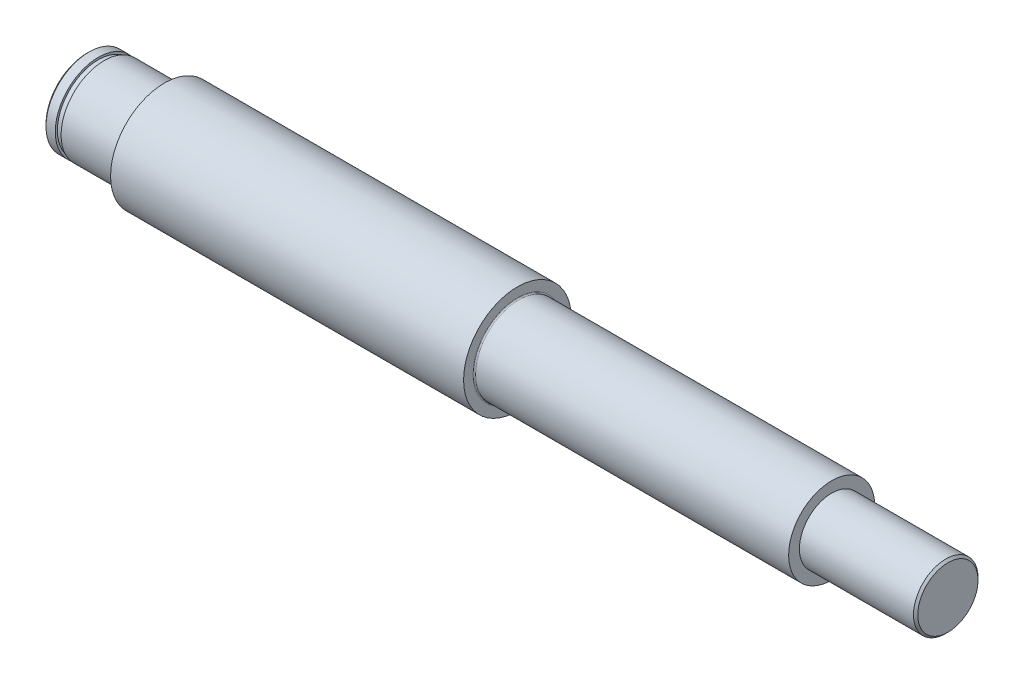
from build123d import *

# Parameters (mm, degrees)
FILLET1_R     = 0.3
CHAMFER1_SIZE = 0.5


with BuildPart() as part:
    # Sketch1 → Revolve1 (revolve)
    with BuildSketch(Plane.XY):
        Polygon((0, 0), (200, 0), (200, 7.5), (173, 7.5), (173, 10), (100, 10), (100, 12.5), (18, 12.5), (18, 10), (4, 10), (4, 9.5), (2.65, 9.5), (2.65, 10), (0, 10), align=None)
    revolve(axis=Axis((0, 0, 0), (1, 0, 0)))

    # Fillet1
    fillet1_edges = [part.edges().sort_by_distance(p)[0] for p in [
        (100, -10, 0),
        (18, -10, 0),
    ]]
    fillet(fillet1_edges, radius=FILLET1_R)

    # Chamfer1
    chamfer1_edges = [part.edges().sort_by_distance(p)[0] for p in [
        (0, -10, 0),
        (200, -7.5, 0),
    ]]
    chamfer(chamfer1_edges, length=CHAMFER1_SIZE)


solid = part.part
